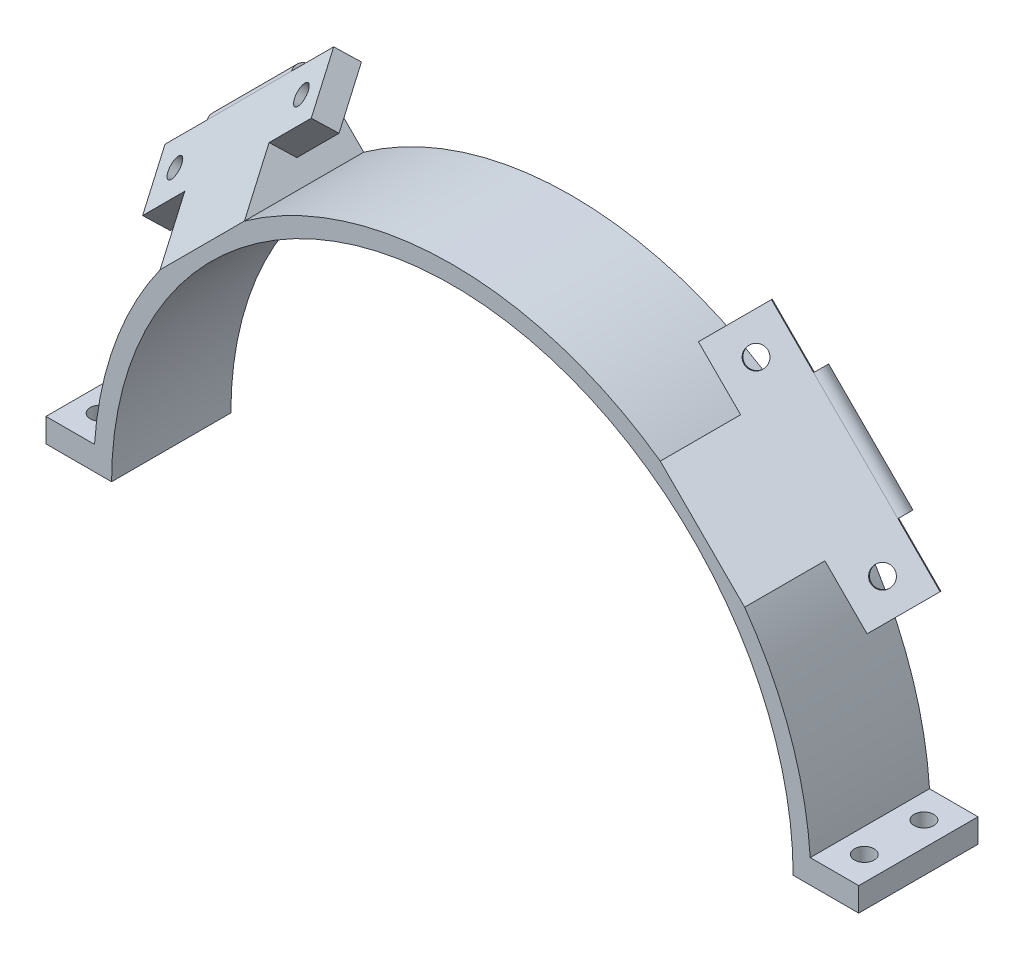
from build123d import *

# Parameters (mm, degrees)
EXTRUDE_1_DEPTH     = 20
EXTRUDE_2_DEPTH     = 20
CUT_EXTRUDE_1_REACH = 99.146
CUT_EXTRUDE_2_REACH = 99.146
EXTRUDE_3_DEPTH     = 4
EXTRUDE_4_DEPTH     = 4
CUT_EXTRUDE_3_REACH = 112.135
SKETCH_8_R          = 1.65
FILLET_1_R          = 2
CUT_EXTRUDE_4_REACH = 112.135
SKETCH_9_R          = 1.65
SKETCH_10_W         = 10
SKETCH_10_H         = 20
EXTRUDE_5_DEPTH     = 4
CUT_EXTRUDE_5_REACH = 95.619
SKETCH_11_R         = 1.65


with BuildPart() as part:
    # ｽｹｯﾁ1 → ﾎﾞｽ - 押し出し1 (new body)
    with BuildSketch(Plane.XY):
        with BuildLine():
            Line((-57.15, 0), (-60.15, 0))
            ThreePointArc((-60.15, 0), (0, 60.15), (60.15, 0))
            Line((60.15, 0), (57.15, 0))
            ThreePointArc((57.15, 0), (0, 57.15), (-57.15, 0))
        make_face()
    extrude(amount=EXTRUDE_1_DEPTH)

    # ｽｹｯﾁ3 → ﾎﾞｽ - 押し出し2 (add)
    with BuildSketch(Plane.XY.offset(20)):
        Polygon((-41.94056807, 41.94056807), (-34.869500258, 49.011635881), (-45.476101976, 59.618237599), (-59.618237599, 45.476101976), (-49.011635881, 34.869500258), align=None)
        Polygon((59.618237599, 45.476101976), (49.011635881, 34.869500258), (41.94056807, 41.94056807), (34.869500258, 49.011635881), (45.476101976, 59.618237599), align=None)
    extrude(amount=-EXTRUDE_2_DEPTH)

    # ｽｹｯﾁ4 → ｶｯﾄ - 押し出し1 (cut, up to next)
    with BuildSketch(Plane(origin=(-7.071067812, -7.071067812, 0), x_dir=(0, 0, 1), z_dir=(-0.7071067811865431, -0.7071067811865519, 0)), mode=Mode.PRIVATE) as cut_extrude_1_sk1:
        Polygon((0, 74.312920178), (20, 59.312920178), (20, 74.312920178), align=None)
    cut_extrude_1_tool1 = extrude(cut_extrude_1_sk1.sketch, amount=-CUT_EXTRUDE_1_REACH, mode=Mode.PRIVATE) & part.part
    add(cut_extrude_1_tool1.solids().sort_by_distance((-56.082704, 41.940568, 13.333333))[0], mode=Mode.SUBTRACT)

    # ｽｹｯﾁ5 → ｶｯﾄ - 押し出し2 (cut, up to next)
    with BuildSketch(Plane(origin=(7.071067812, -7.071067812, 0), x_dir=(0, 0, -1), z_dir=(0.7071067811865431, -0.7071067811865519, 0)), mode=Mode.PRIVATE) as cut_extrude_2_sk1:
        Polygon((0, 74.312920178), (-20, 59.312920178), (-20, 74.312920178), align=None)
    cut_extrude_2_tool1 = extrude(cut_extrude_2_sk1.sketch, amount=-CUT_EXTRUDE_2_REACH, mode=Mode.PRIVATE) & part.part
    add(cut_extrude_2_tool1.solids().sort_by_distance((56.082704, 41.940568, 13.333333))[0], mode=Mode.SUBTRACT)

    # ｽｹｯﾁ6 → ﾎﾞｽ - 押し出し3 (add)
    with BuildSketch(Plane(origin=(-33.630188664, 33.630188664, 35.670201685), x_dir=(0.8246211251235299, 0.3880570000581333, 0.41159660434202516), z_dir=(-0.5656854249492413, 0.5656854249492345, 0.6000000000000004))):
        Polygon((-29.457155438, 29.658752748), (-38.032084695, 24.513795193), (-32.887127141, 15.938865936), (-24.312197884, 21.083823491), align=None)
        Polygon((1.412589887, 36.518696153), (-7.16233937, 31.373738599), (-12.307296924, 39.948667856), (-3.732367667, 45.093625411), align=None)
    extrude(amount=-EXTRUDE_3_DEPTH)

    # ｽｹｯﾁ7 → ﾎﾞｽ - 押し出し4 (add)
    with BuildSketch(Plane(origin=(33.630188664, 33.630188664, 35.670201685), x_dir=(0.8246211251235299, -0.38805700005813326, -0.4115966043420252), z_dir=(0.5656854249492413, 0.5656854249492342, 0.6000000000000005))):
        Polygon((12.307296924, 39.948667856), (7.16233937, 31.373738599), (-1.412589887, 36.518696153), (3.732367667, 45.093625411), align=None)
        Polygon((32.887127141, 15.938865936), (38.032084695, 24.513795193), (29.457155438, 29.658752748), (24.312197884, 21.083823491), align=None)
    extrude(amount=-EXTRUDE_4_DEPTH)

    # ｽｹｯﾁ8 → ｶｯﾄ - 押し出し3 (cut, up to next)
    with BuildSketch(Plane(origin=(33.630188664, 33.630188664, 35.670201685), x_dir=(0.8246211251235299, -0.38805700005813326, -0.4115966043420252), z_dir=(0.5656854249492413, 0.5656854249492342, 0.6000000000000005)), mode=Mode.PRIVATE) as cut_extrude_3_sk1:
        with Locations(Location((5.447353518, 38.233682005, 0), (0, 0, 28.072486936))):
            Circle(SKETCH_8_R)
    cut_extrude_3_tool1 = extrude(cut_extrude_3_sk1.sketch, amount=-CUT_EXTRUDE_3_REACH, mode=Mode.PRIVATE) & part.part
    # ｽｹｯﾁ8 → ｶｯﾄ - 押し出し3 (cut, up to next)
    with BuildSketch(Plane(origin=(33.630188664, 33.630188664, 35.670201685), x_dir=(0.8246211251235299, -0.38805700005813326, -0.4115966043420252), z_dir=(0.5656854249492413, 0.5656854249492342, 0.6000000000000005)), mode=Mode.PRIVATE) as cut_extrude_3_sk2:
        with Locations(Location((31.17214129, 22.798809342, 0), (0, 0, 28.072486936))):
            Circle(SKETCH_8_R)
    cut_extrude_3_tool2 = extrude(cut_extrude_3_sk2.sketch, amount=-CUT_EXTRUDE_3_REACH, mode=Mode.PRIVATE) & part.part
    add(cut_extrude_3_tool1.solids().sort_by_distance((38.122191, 59.335395, 7.2))[0], mode=Mode.SUBTRACT)
    add(cut_extrude_3_tool2.solids().sort_by_distance((59.335395, 38.122191, 7.2))[0], mode=Mode.SUBTRACT)

    # ﾌｨﾚｯﾄ1
    fillet_1_edges = [part.edges().sort_by_distance(p)[0] for p in [
        (52.547169787, 52.547169787, 0),
        (-52.547169787, 52.547169787, 0),
    ]]
    fillet(fillet_1_edges, radius=FILLET_1_R)

    # ｽｹｯﾁ9 → ｶｯﾄ - 押し出し4 (cut, up to next)
    with BuildSketch(Plane(origin=(-33.630188664, 33.630188664, 35.670201685), x_dir=(0.8246211251235299, 0.3880570000581333, 0.41159660434202516), z_dir=(-0.5656854249492413, 0.5656854249492345, 0.6000000000000004)), mode=Mode.PRIVATE) as cut_extrude_4_sk1:
        with Locations(Location((-5.447353518, 38.233682005, 0), (0, 0, 331.927513064))):
            Circle(SKETCH_9_R)
    cut_extrude_4_tool1 = extrude(cut_extrude_4_sk1.sketch, amount=-CUT_EXTRUDE_4_REACH, mode=Mode.PRIVATE) & part.part
    # ｽｹｯﾁ9 → ｶｯﾄ - 押し出し4 (cut, up to next)
    with BuildSketch(Plane(origin=(-33.630188664, 33.630188664, 35.670201685), x_dir=(0.8246211251235299, 0.3880570000581333, 0.41159660434202516), z_dir=(-0.5656854249492413, 0.5656854249492345, 0.6000000000000004)), mode=Mode.PRIVATE) as cut_extrude_4_sk2:
        with Locations(Location((-31.17214129, 22.798809342, 0), (0, 0, 331.927513064))):
            Circle(SKETCH_9_R)
    cut_extrude_4_tool2 = extrude(cut_extrude_4_sk2.sketch, amount=-CUT_EXTRUDE_4_REACH, mode=Mode.PRIVATE) & part.part
    add(cut_extrude_4_tool1.solids().sort_by_distance((-38.122191, 59.335395, 7.2))[0], mode=Mode.SUBTRACT)
    add(cut_extrude_4_tool2.solids().sort_by_distance((-59.335395, 38.122191, 7.2))[0], mode=Mode.SUBTRACT)

    # ｽｹｯﾁ10 → ﾎﾞｽ - 押し出し5 (add)
    with BuildSketch(Plane.XZ):
        with Locations((-63.15, 10)):
            Rectangle(SKETCH_10_W, SKETCH_10_H)
        with Locations((63.15, 10)):
            Rectangle(SKETCH_10_W, SKETCH_10_H)
    extrude(amount=-EXTRUDE_5_DEPTH)

    # ｽｹｯﾁ11 → ｶｯﾄ - 押し出し5 (cut, up to next)
    with BuildSketch(Plane(origin=(0, 4, 0), x_dir=(1, 0, 0), z_dir=(0, 1, 0)), mode=Mode.PRIVATE) as cut_extrude_5_sk1:
        with Locations(Location((64.0834259, -5, 0), (0, 0, 180))):
            Circle(SKETCH_11_R)
    cut_extrude_5_tool1 = extrude(cut_extrude_5_sk1.sketch, amount=-CUT_EXTRUDE_5_REACH, mode=Mode.PRIVATE) & part.part
    # ｽｹｯﾁ11 → ｶｯﾄ - 押し出し5 (cut, up to next)
    with BuildSketch(Plane(origin=(0, 4, 0), x_dir=(1, 0, 0), z_dir=(0, 1, 0)), mode=Mode.PRIVATE) as cut_extrude_5_sk2:
        with Locations(Location((64.0834259, -15, 0), (0, 0, 180))):
            Circle(SKETCH_11_R)
    cut_extrude_5_tool2 = extrude(cut_extrude_5_sk2.sketch, amount=-CUT_EXTRUDE_5_REACH, mode=Mode.PRIVATE) & part.part
    # ｽｹｯﾁ11 → ｶｯﾄ - 押し出し5 (cut, up to next)
    with BuildSketch(Plane(origin=(0, 4, 0), x_dir=(1, 0, 0), z_dir=(0, 1, 0)), mode=Mode.PRIVATE) as cut_extrude_5_sk3:
        with Locations(Location((-64.0834259, -15, 0), (0, 0, 180))):
            Circle(SKETCH_11_R)
    cut_extrude_5_tool3 = extrude(cut_extrude_5_sk3.sketch, amount=-CUT_EXTRUDE_5_REACH, mode=Mode.PRIVATE) & part.part
    # ｽｹｯﾁ11 → ｶｯﾄ - 押し出し5 (cut, up to next)
    with BuildSketch(Plane(origin=(0, 4, 0), x_dir=(1, 0, 0), z_dir=(0, 1, 0)), mode=Mode.PRIVATE) as cut_extrude_5_sk4:
        with Locations(Location((-64.0834259, -5, 0), (0, 0, 180))):
            Circle(SKETCH_11_R)
    cut_extrude_5_tool4 = extrude(cut_extrude_5_sk4.sketch, amount=-CUT_EXTRUDE_5_REACH, mode=Mode.PRIVATE) & part.part
    add(cut_extrude_5_tool1.solids().sort_by_distance((64.083426, 4, 5))[0], mode=Mode.SUBTRACT)
    add(cut_extrude_5_tool2.solids().sort_by_distance((64.083426, 4, 15))[0], mode=Mode.SUBTRACT)
    add(cut_extrude_5_tool3.solids().sort_by_distance((-64.083426, 4, 15))[0], mode=Mode.SUBTRACT)
    add(cut_extrude_5_tool4.solids().sort_by_distance((-64.083426, 4, 5))[0], mode=Mode.SUBTRACT)


solid = part.part
